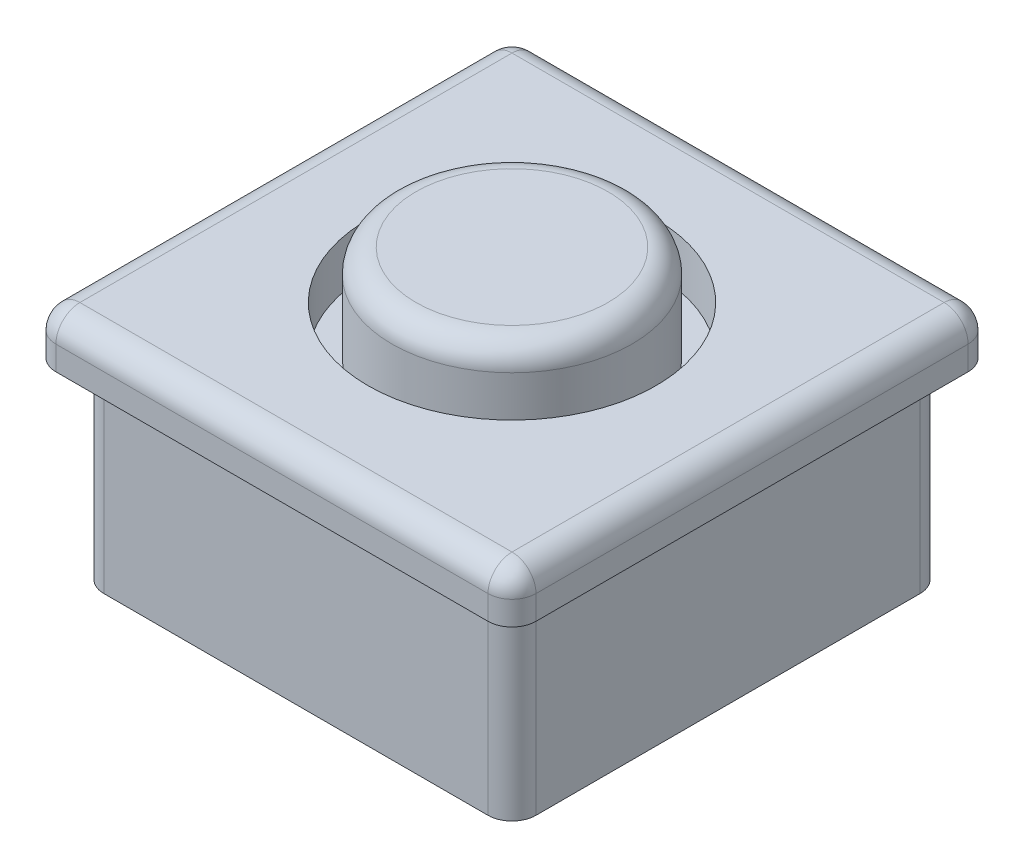
from build123d import *

# Parameters (mm, degrees)
SKETCH1_R           = 6
BOSS_EXTRUDE1_DEPTH = 2
BOSS_EXTRUDE2_DEPTH = 8
SKETCH3_R           = 5
BOSS_EXTRUDE3_DEPTH = 4
FILLET1_R           = 1


with BuildPart() as part:
    # Sketch1 → Boss-Extrude1 (new body)
    with BuildSketch(Plane(origin=(0, 0, 0), x_dir=(1, 0, 0), z_dir=(0, 1, 0))):
        with BuildLine():
            Line((1, 0), (19, 0))
            ThreePointArc((19, 0), (19.707106781, 0.292893219), (20, 1))
            Line((20, 1), (20, 19))
            ThreePointArc((20, 19), (19.707106781, 19.707106781), (19, 20))
            Line((19, 20), (1, 20))
            ThreePointArc((1, 20), (0.292893219, 19.707106781), (0, 19))
            Line((0, 19), (0, 1))
            ThreePointArc((0, 1), (0.292893219, 0.292893219), (1, 0))
        make_face()
        with Locations(Location((10, 10, 0), (0, 0, 270))):
            Circle(SKETCH1_R, mode=Mode.SUBTRACT)
    extrude(amount=BOSS_EXTRUDE1_DEPTH)

    # Sketch2 → Boss-Extrude2 (add)
    with BuildSketch(Plane(origin=(0, 0, 0), x_dir=(1, 0, 0), z_dir=(0, 1, 0))):
        with BuildLine():
            Line((2, 1), (18, 1))
            ThreePointArc((18, 1), (18.707106781, 1.292893219), (19, 2))
            Line((19, 2), (19, 18))
            ThreePointArc((19, 18), (18.707106781, 18.707106781), (18, 19))
            Line((18, 19), (2, 19))
            ThreePointArc((2, 19), (1.292893219, 18.707106781), (1, 18))
            Line((1, 18), (1, 2))
            ThreePointArc((1, 2), (1.292893219, 1.292893219), (2, 1))
        make_face()
    extrude(amount=-BOSS_EXTRUDE2_DEPTH)

    # Sketch3 → Boss-Extrude3 (add)
    with BuildSketch(Plane(origin=(0, 0, 0), x_dir=(1, 0, 0), z_dir=(0, 1, 0))):
        with Locations(Location((10, 10, 0), (0, 0, 270))):
            Circle(SKETCH3_R)
    extrude(amount=BOSS_EXTRUDE3_DEPTH)

    # Fillet1
    fillet1_edges = [part.edges().sort_by_distance(p)[0] for p in [
        (19.707106781, 2, -0.292893219),
        (20, 2, -10),
        (19.707106781, 2, -19.707106781),
        (10, 2, -20),
        (0.292893219, 2, -19.707106781),
        (0, 2, -10),
        (0.292893219, 2, -0.292893219),
        (10, 4, -15),
        (10, 2, 0),
    ]]
    fillet(fillet1_edges, radius=FILLET1_R)


solid = part.part
